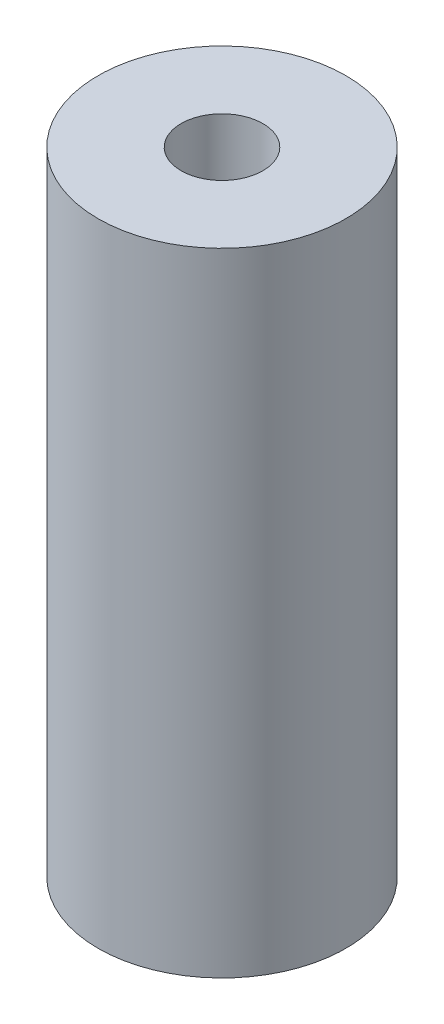
from build123d import *

# Parameters (mm, degrees)
SKETCH_1_R      = 5
SKETCH_1_R_2    = 1.65
EXTRUDE_1_DEPTH = 25.5


with BuildPart() as part:
    # Эскиз1 → Бобышка-Вытянуть1 (new body)
    with BuildSketch(Plane(origin=(0, 0, 0), x_dir=(1, 0, 0), z_dir=(0, 1, 0))):
        with Locations(Location((0, 0, 0), (0, 0, 270))):
            Circle(SKETCH_1_R)
        with Locations(Location((0, 0, 0), (0, 0, 270))):
            Circle(SKETCH_1_R_2, mode=Mode.SUBTRACT)
    extrude(amount=EXTRUDE_1_DEPTH)


solid = part.part
